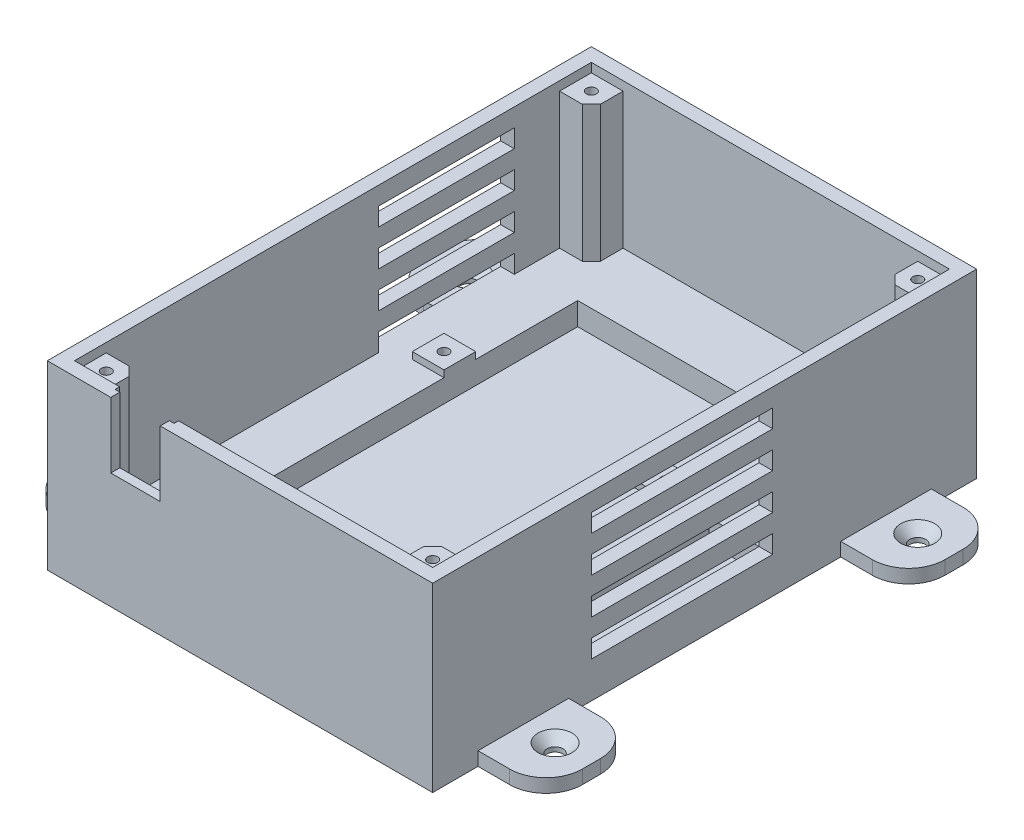
from build123d import *

# Parameters (mm, degrees)
SKETCH_1_W               = 85
SKETCH_1_H               = 120
EXTRUDE_1_DEPTH          = 40
SKETCH_2_W               = 79
SKETCH_2_H               = 114
CUT_EXTRUDE_1_DEPTH      = 32
SKETCH_3_W               = 42
SKETCH_3_H               = 84
CUT_EXTRUDE_2_DEPTH      = 5
SKETCH_4_W               = 7
SKETCH_4_H               = 7
EXTRUDE_2_DEPTH          = 1.5
SKETCH_5_R               = 1.1
CUT_EXTRUDE_3_DEPTH      = 6
EXTRUDE_3_DEPTH          = 30
SKETCH_7_R               = 1.1
CUT_EXTRUDE_4_DEPTH      = 25
EXTRUDE_4_DEPTH          = 3
SKETCH_9_R               = 1.75
CUT_EXTRUDE_5_DEPTH      = 91.968401107
PATTERN_LINEAR_1_COUNT   = 2
PATTERN_LINEAR_1_PITCH   = 80
MIRROR_1_COPY_1_DEPTH    = 3
MIRROR_1_COPY_2_SKETCH_R = 1.75
MIRROR_1_COPY_2_DEPTH    = 91.968401107
CHAMFER_2_SIZE           = 2
SKETCH_10_W              = 10.9
SKETCH_10_H              = 16.45
CUT_EXTRUDE_6_DEPTH      = 5
SKETCH_11_W              = 13
SKETCH_11_H              = 2
CUT_EXTRUDE_7_DEPTH      = 15.5
SKETCH_12_W              = 40
SKETCH_12_H              = 4
CUT_EXTRUDE_8_DEPTH      = 10
SKETCH_13_W              = 30
SKETCH_13_H              = 4
CUT_EXTRUDE_9_DEPTH      = 5
SKETCH_14_W              = 11
SKETCH_14_H              = 40
CUT_EXTRUDE_10_DEPTH     = 5


with BuildPart() as part:
    # Эскиз1 → Бобышка-Вытянуть1 (new body)
    with BuildSketch(Plane(origin=(0, 0, 0), x_dir=(1, 0, 0), z_dir=(0, 1, 0))):
        Rectangle(SKETCH_1_W, SKETCH_1_H)
    extrude(amount=EXTRUDE_1_DEPTH)

    # Эскиз2 → Вырез-Вытянуть1 (cut)
    with BuildSketch(Plane(origin=(0, 40, 0), x_dir=(1, 0, 0), z_dir=(0, 1, 0))):
        Rectangle(SKETCH_2_W, SKETCH_2_H)
    extrude(amount=-CUT_EXTRUDE_1_DEPTH, mode=Mode.SUBTRACT)

    # Эскиз3 → Вырез-Вытянуть2 (cut)
    with BuildSketch(Plane(origin=(0, 8, 0), x_dir=(1, 0, 0), z_dir=(0, 1, 0))):
        with Locations((-6.5, 0)):
            Rectangle(SKETCH_3_W, SKETCH_3_H)
    extrude(amount=-CUT_EXTRUDE_2_DEPTH, mode=Mode.SUBTRACT)

    # Эскиз4 → Бобышка-Вытянуть2 (add)
    with BuildSketch(Plane(origin=(0, 8, 0), x_dir=(1, 0, 0), z_dir=(0, 1, 0))):
        with Locations((-31, 16)):
            Rectangle(SKETCH_4_W, SKETCH_4_H)
        with Locations((18, 16)):
            Rectangle(SKETCH_4_W, SKETCH_4_H)
        with Locations((-31, -42)):
            Rectangle(SKETCH_4_W, SKETCH_4_H)
        with Locations((18, -42)):
            Rectangle(SKETCH_4_W, SKETCH_4_H)
    extrude(amount=EXTRUDE_2_DEPTH)

    # Эскиз5 → Вырез-Вытянуть3 (cut)
    with BuildSketch(Plane(origin=(0, 9.5, 0), x_dir=(1, 0, 0), z_dir=(0, 1, 0))):
        with Locations(Location((-31, 16, 0), (0, 0, 270))):
            Circle(SKETCH_5_R)
        with Locations(Location((18, 16, 0), (0, 0, 270))):
            Circle(SKETCH_5_R)
        with Locations(Location((18, -42, 0), (0, 0, 270))):
            Circle(SKETCH_5_R)
        with Locations(Location((-31, -42, 0), (0, 0, 270))):
            Circle(SKETCH_5_R)
    extrude(amount=-CUT_EXTRUDE_3_DEPTH, mode=Mode.SUBTRACT)

    # Эскиз6 → Бобышка-Вытянуть3 (add)
    with BuildSketch(Plane(origin=(0, 8, 0), x_dir=(1, 0, 0), z_dir=(0, 1, 0))):
        Polygon((-32.5, 52), (-34.5, 50), (-39.5, 50), (-39.5, 57), (-32.5, 57), align=None)
        Polygon((34.5, 50), (32.5, 52), (32.5, 57), (39.5, 57), (39.5, 50), align=None)
        Polygon((-39.5, -57), (-32.5, -57), (-32.5, -52), (-34.5, -50), (-39.5, -50), align=None)
        Polygon((39.5, -57), (32.5, -57), (32.5, -52), (34.5, -50), (39.5, -50), align=None)
    extrude(amount=EXTRUDE_3_DEPTH)

    # Эскиз7 → Вырез-Вытянуть4 (cut)
    with BuildSketch(Plane(origin=(0, 38, 0), x_dir=(1, 0, 0), z_dir=(0, 1, 0))):
        with Locations(Location((-36, 53.5, 0), (0, 0, 270))):
            Circle(SKETCH_7_R)
        with Locations(Location((36, 53.5, 0), (0, 0, 270))):
            Circle(SKETCH_7_R)
        with Locations(Location((-36, -53.5, 0), (0, 0, 270))):
            Circle(SKETCH_7_R)
        with Locations(Location((36, -53.5, 0), (0, 0, 270))):
            Circle(SKETCH_7_R)
    extrude(amount=-CUT_EXTRUDE_4_DEPTH, mode=Mode.SUBTRACT)

    # Эскиз8 → Бобышка-Вытянуть4 (add)
    with BuildSketch(Plane(origin=(0, 0, 0), x_dir=(1, 0, 0), z_dir=(0, 1, 0))):
        with BuildLine():
            Line((-40.5, 50), (-49.5, 50))
            ThreePointArc((-49.5, 50), (-55.156854249, 47.656854249), (-57.5, 42))
            Line((-57.5, 42), (-57.5, 38))
            ThreePointArc((-57.5, 38), (-55.156854249, 32.343145751), (-49.5, 30))
            Line((-49.5, 30), (-40.5, 30))
            Line((-40.5, 30), (-40.5, 50))
        make_face()
    extrude_4 = extrude(amount=EXTRUDE_4_DEPTH)

    # Эскиз9 → Вырез-Вытянуть5 (cut, through all)
    with BuildSketch(Plane(origin=(0, 3, 0), x_dir=(1, 0, 0), z_dir=(0, 1, 0))):
        with Locations(Location((-49.5, 40, 0), (0, 0, 270))):
            Circle(SKETCH_9_R)
    cut_extrude_5 = extrude(amount=-CUT_EXTRUDE_5_DEPTH, mode=Mode.SUBTRACT)

    # Линейный массив1: Бобышка-Вытянуть4, Вырез-Вытянуть5 ×2
    with Locations(*[(0, 0, i * PATTERN_LINEAR_1_PITCH) for i in range(1, PATTERN_LINEAR_1_COUNT)]):
        add(extrude_4)
        add(cut_extrude_5, mode=Mode.SUBTRACT)

    # Зеркальное отражение1: Бобышка-Вытянуть4, Вырез-Вытянуть5 across plane
    add(extrude_4.mirror(Plane(origin=(0, 0, 0), x_dir=(0, 0, 1), z_dir=(1, 0, 0))))
    add(cut_extrude_5.mirror(Plane(origin=(0, 0, 0), x_dir=(0, 0, 1), z_dir=(1, 0, 0))), mode=Mode.SUBTRACT)

    # Зеркальное отражение1 copy 1 sketch → Зеркальное отражение1 copy 1 (add)
    with BuildSketch(Plane(origin=(0, 0, 80), x_dir=(-1, 0, 0), z_dir=(0, 1, 0))):
        with BuildLine():
            Line((-40.5, -50), (-49.5, -50))
            ThreePointArc((-49.5, -50), (-55.156854249, -47.656854249), (-57.5, -42))
            Line((-57.5, -42), (-57.5, -38))
            ThreePointArc((-57.5, -38), (-55.156854249, -32.343145751), (-49.5, -30))
            Line((-49.5, -30), (-40.5, -30))
            Line((-40.5, -30), (-40.5, -50))
        make_face()
    extrude(amount=MIRROR_1_COPY_1_DEPTH)

    # Зеркальное отражение1 copy 2 sketch → Зеркальное отражение1 copy 2 (cut, through all)
    with BuildSketch(Plane(origin=(0, 3, 80), x_dir=(-1, 0, 0), z_dir=(0, 1, 0))):
        with Locations((-49.5, -40)):
            Circle(MIRROR_1_COPY_2_SKETCH_R)
    extrude(amount=-MIRROR_1_COPY_2_DEPTH, mode=Mode.SUBTRACT)

    # Фаска2
    chamfer_2_edges = [part.edges().sort_by_distance(p)[0] for p in [
        (-49.5, 3, -41.75),
        (-49.5, 3, 38.25),
        (49.5, 3, -41.75),
        (51.25, 3, 40),
    ]]
    chamfer(chamfer_2_edges, length=CHAMFER_2_SIZE)

    # Эскиз10 → Вырез-Вытянуть6 (cut)
    with BuildSketch(Plane.XY.offset(60)):
        with Locations((-23.05, 33.775)):
            Rectangle(SKETCH_10_W, SKETCH_10_H)
    extrude(amount=-CUT_EXTRUDE_6_DEPTH, mode=Mode.SUBTRACT)

    # Эскиз11 → Вырез-Вытянуть7 (cut)
    with BuildSketch(Plane(origin=(0, 40, 0), x_dir=(1, 0, 0), z_dir=(0, 1, 0))):
        with Locations((-23.05, -57)):
            Rectangle(SKETCH_11_W, SKETCH_11_H)
    extrude(amount=-CUT_EXTRUDE_7_DEPTH, mode=Mode.SUBTRACT)

    # Эскиз12 → Вырез-Вытянуть8 (cut)
    with BuildSketch(Plane(origin=(42.5, 0, 0), x_dir=(0, 0, -1), z_dir=(1, 0, 0))):
        with Locations((-5, 34)):
            Rectangle(SKETCH_12_W, SKETCH_12_H)
        with Locations((-5, 26)):
            Rectangle(SKETCH_12_W, SKETCH_12_H)
        with Locations((-5, 18)):
            Rectangle(SKETCH_12_W, SKETCH_12_H)
        with Locations((-5, 10)):
            Rectangle(SKETCH_12_W, SKETCH_12_H)
    extrude(amount=-CUT_EXTRUDE_8_DEPTH, mode=Mode.SUBTRACT)

    # Эскиз13 → Вырез-Вытянуть9 (cut)
    with BuildSketch(Plane.ZY.offset(42.5)):
        with Locations((-25, 34)):
            Rectangle(SKETCH_13_W, SKETCH_13_H)
        with Locations((-25, 26)):
            Rectangle(SKETCH_13_W, SKETCH_13_H)
        with Locations((-25, 18)):
            Rectangle(SKETCH_13_W, SKETCH_13_H)
        with Locations((-25, 10)):
            Rectangle(SKETCH_13_W, SKETCH_13_H)
    extrude(amount=-CUT_EXTRUDE_9_DEPTH, mode=Mode.SUBTRACT)

    # Эскиз14 → Вырез-Вытянуть10 (cut)
    with BuildSketch(Plane(origin=(0, 8, 0), x_dir=(1, 0, 0), z_dir=(0, 1, 0))):
        with Locations((34, -5)):
            Rectangle(SKETCH_14_W, SKETCH_14_H)
    extrude(amount=-CUT_EXTRUDE_10_DEPTH, mode=Mode.SUBTRACT)


solid = part.part
